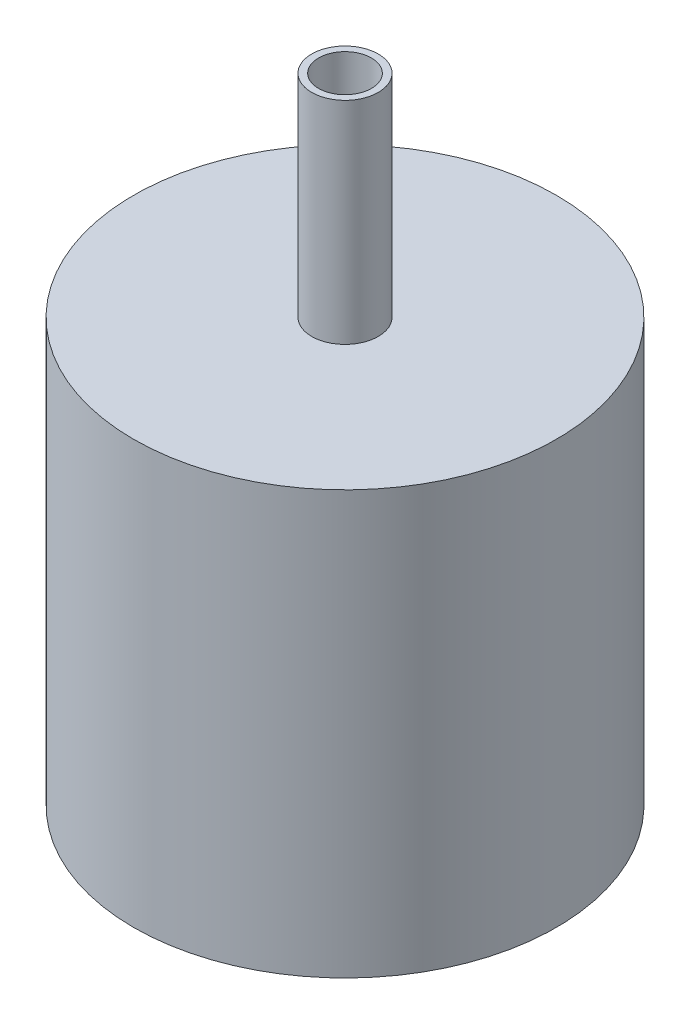
from build123d import *

# Parameters (mm, degrees)
SKETCH1_R                    = 12.7
BOSS_EXTRUDE1_DEPTH          = 25.4
SKETCH2_R                    = 7.9375
CUT_EXTRUDE1_DEPTH           = 3.175
SKETCH12_R                   = 1.999996
BOSS_EXTRUDE3_DEPTH          = 12.7
F_1_8_0_125_DIAMETER_HOLE1_D = 3.175


with BuildPart() as part:
    # Sketch1 → Boss-Extrude1 (new body)
    with BuildSketch(Plane(origin=(0, 0, 0), x_dir=(1, 0, 0), z_dir=(0, 1, 0))):
        with Locations(Location((0, 0, 0), (0, 0, 270))):
            Circle(SKETCH1_R)
    extrude(amount=BOSS_EXTRUDE1_DEPTH)

    # Sketch2 → Cut-Extrude1 (cut)
    with BuildSketch(Plane(origin=(0, 0, 0), x_dir=(1, 0, 0), z_dir=(0, 1, 0))):
        with Locations(Location((0, 0, 0), (0, 0, 270))):
            Circle(SKETCH2_R)
    extrude(amount=CUT_EXTRUDE1_DEPTH, mode=Mode.SUBTRACT)

    # Sketch12 → Boss-Extrude3 (add)
    with BuildSketch(Plane(origin=(0, 25.4, 0), x_dir=(1, 0, 0), z_dir=(0, 1, 0))):
        with Locations(Location((0, 0, 0), (0, 0, 270))):
            Circle(SKETCH12_R)
    extrude(amount=BOSS_EXTRUDE3_DEPTH)

    # 1/8 (0.125) Diameter Hole1 (through all)
    with Locations(Plane(origin=(0, 3.175, 0), x_dir=(-1, 0, 0), z_dir=(0, -1, 0))):
        with Locations((0, 0)):
            Hole(F_1_8_0_125_DIAMETER_HOLE1_D / 2)


solid = part.part
